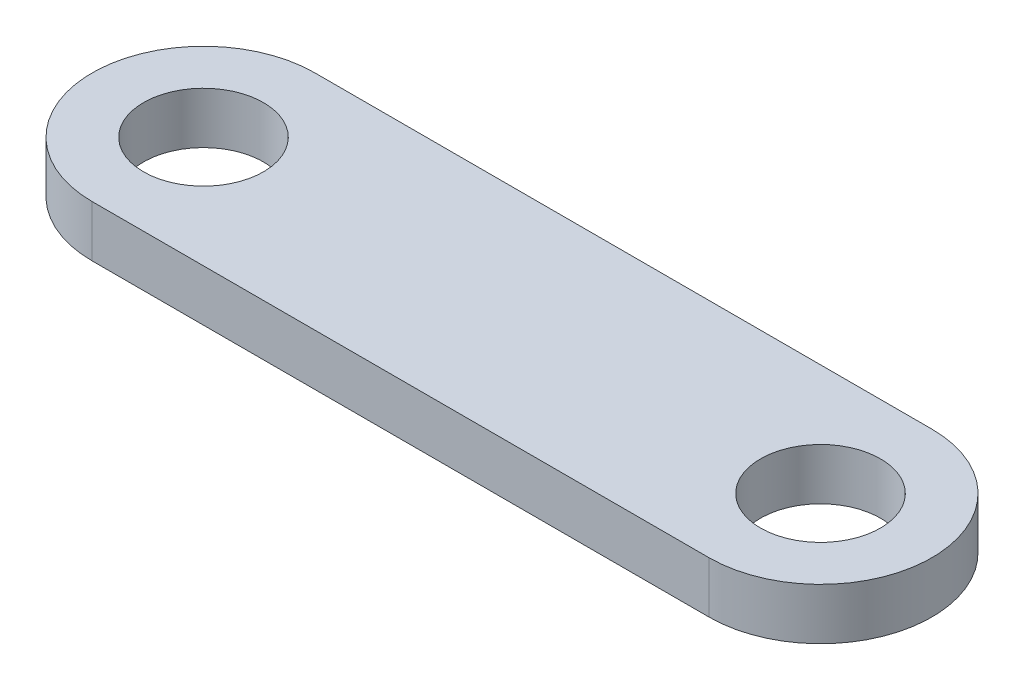
from build123d import *

# Parameters (mm, degrees)
SKETCH1_R           = 3.5
BOSS_EXTRUDE1_DEPTH = 3


with BuildPart() as part:
    # Sketch1 → Boss-Extrude1 (new body)
    with BuildSketch(Plane(origin=(0, 0, 0), x_dir=(1, 0, 0), z_dir=(0, 1, 0))):
        with BuildLine():
            Line((-18, 6.5), (18, 6.5))
            ThreePointArc((18, 6.5), (24.5, 0), (18, -6.5))
            Line((18, -6.5), (-18, -6.5))
            ThreePointArc((-18, -6.5), (-24.5, 0), (-18, 6.5))
        make_face()
        with Locations(Location((-18, 0, 0), (0, 0, 270))):
            Circle(SKETCH1_R, mode=Mode.SUBTRACT)
        with Locations(Location((18, 0, 0), (0, 0, 270))):
            Circle(SKETCH1_R, mode=Mode.SUBTRACT)
    extrude(amount=BOSS_EXTRUDE1_DEPTH)


solid = part.part
